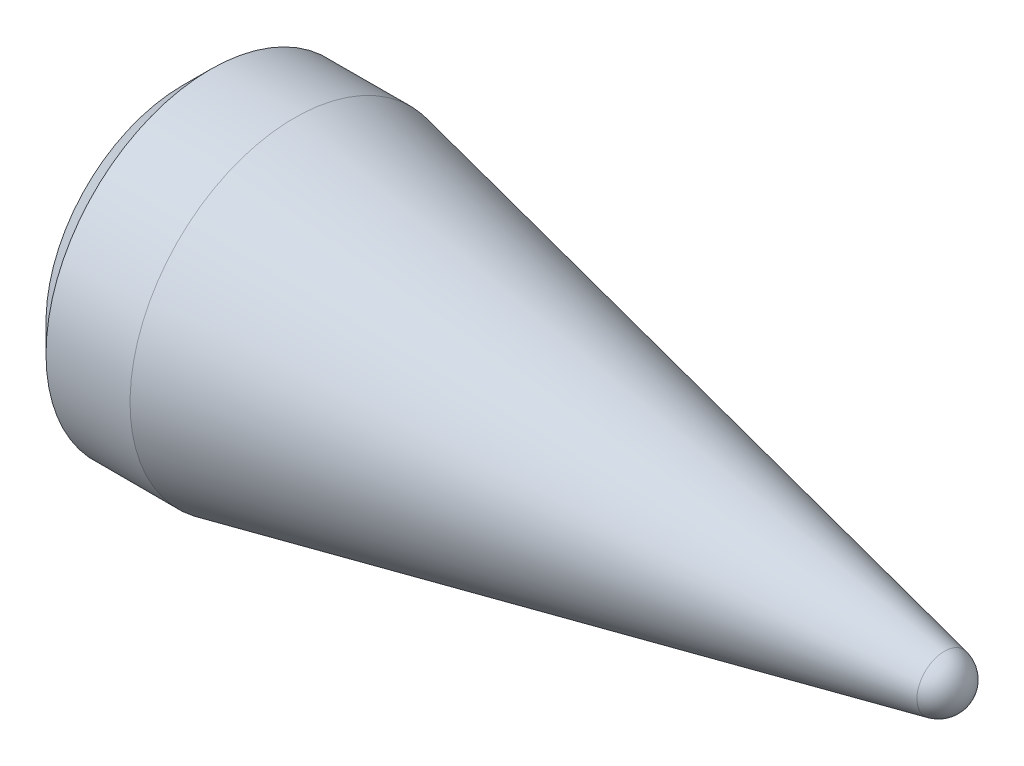
from build123d import *

# Parameters (mm, degrees)
CHAMFER1_SIZE = 3.175


with BuildPart() as part:
    # Sketch1 → Revolve1 (revolve)
    with BuildSketch(Plane.XY, mode=Mode.PRIVATE) as revolve1_sk:
        with BuildLine():
            Line((45.476985206, 3.106629971), (-28.203358387, 18.649498452))
            Line((-28.203358387, 18.649498452), (-40.903358387, 18.649498452))
            Line((-40.903358387, 18.649498452), (-40.903358387, 0))
            Line((-40.903358387, 0), (47.996641613, 0))
            ThreePointArc((47.996641613, 0), (47.287543163, 1.999988637), (45.476985206, 3.106629971))
        make_face()
    revolve(revolve1_sk.sketch.rotate(Axis((-40.903358387, 0, 0), (1, 0, 0)), 180), axis=Axis((-40.903358387, 0, 0), (1, 0, 0)))

    # Chamfer1
    chamfer1_edges = [part.edges().sort_by_distance(p)[0] for p in [
        (-40.903358387, 18.649498452, 0),
    ]]
    chamfer(chamfer1_edges, length=CHAMFER1_SIZE)


solid = part.part
